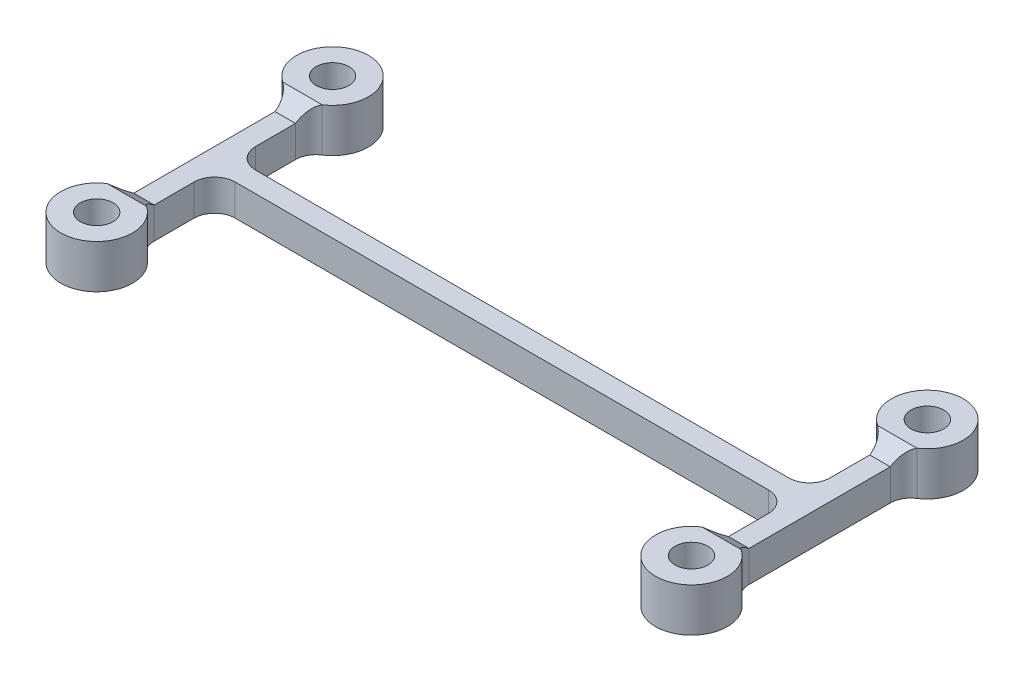
from build123d import *

# Parameters (mm, degrees)
BOSS_EXTRUDE1_DEPTH        = 4.25
F_3_2_3_2_DIAMETER_HOLE1_D = 3.2
CUT_EXTRUDE1_DEPTH         = 37.614339148
CUT_EXTRUDE1_DEPTH_BACK    = 37.614339148


with BuildPart() as part:
    # Sketch2 → Boss-Extrude1 (new body)
    with BuildSketch(Plane(origin=(0, 0, 0), x_dir=(1, 0, 0), z_dir=(0, 1, 0))):
        with BuildLine():
            Line((-26, -2.318619158), (26, -2.318619158))
            ThreePointArc((26, -2.318619158), (27.414213562, -2.904405596), (28, -4.318619158))
            Line((28, -4.318619158), (28, -8.208846929))
            ThreePointArc((28, -8.208846929), (27.758098146, -9.162309518), (27.090909091, -9.88512774))
            ThreePointArc((27.090909091, -9.88512774), (29, -16.318619158), (30.909090909, -9.88512774))
            ThreePointArc((30.909090909, -9.88512774), (30.241901854, -9.162309518), (30, -8.208846929))
            Line((30, -8.208846929), (30, 5.571608613))
            ThreePointArc((30, 5.571608613), (30.241901854, 6.525071203), (30.909090909, 7.247889424))
            ThreePointArc((30.909090909, 7.247889424), (29, 13.681380842), (27.090909091, 7.247889424))
            ThreePointArc((27.090909091, 7.247889424), (27.758098146, 6.525071203), (28, 5.571608613))
            Line((28, 5.571608613), (28, 1.681380842))
            ThreePointArc((28, 1.681380842), (27.414213562, 0.26716728), (26, -0.318619158))
            Line((26, -0.318619158), (-26, -0.318619158))
            ThreePointArc((-26, -0.318619158), (-27.414213562, 0.26716728), (-28, 1.681380842))
            Line((-28, 1.681380842), (-28, 5.571608613))
            ThreePointArc((-28, 5.571608613), (-27.758098146, 6.525071203), (-27.090909091, 7.247889424))
            ThreePointArc((-27.090909091, 7.247889424), (-29, 13.681380842), (-30.909090909, 7.247889424))
            ThreePointArc((-30.909090909, 7.247889424), (-30.241901854, 6.525071203), (-30, 5.571608613))
            Line((-30, 5.571608613), (-30, -8.208846929))
            ThreePointArc((-30, -8.208846929), (-30.241901854, -9.162309518), (-30.909090909, -9.88512774))
            ThreePointArc((-30.909090909, -9.88512774), (-29, -16.318619158), (-27.090909091, -9.88512774))
            ThreePointArc((-27.090909091, -9.88512774), (-27.758098146, -9.162309518), (-28, -8.208846929))
            Line((-28, -8.208846929), (-28, -4.318619158))
            ThreePointArc((-28, -4.318619158), (-27.414213562, -2.904405596), (-26, -2.318619158))
        make_face()
    extrude(amount=BOSS_EXTRUDE1_DEPTH)

    # Ø3.2 (3.2) Diameter Hole1 (through all)
    with Locations(Plane(origin=(0, 4.25, 0), x_dir=(1, 0, 0), z_dir=(0, 1, 0))):
        with Locations((-29, -12.818619158), (-29, 10.181380842), (29, 10.181380842), (29, -12.818619158)):
            Hole(F_3_2_3_2_DIAMETER_HOLE1_D / 2)

    # Sketch5 → Cut-Extrude1 (cut, two sides: drawn at the far end of the back side and taken through both)
    with BuildSketch(Plane(origin=(0, 0, 0), x_dir=(0, 0, -1), z_dir=(1, 0, 0)).offset(-CUT_EXTRUDE1_DEPTH_BACK)):
        Polygon((-8.208846929, 3.055472707), (5.571608613, 3.055472707), (7.247889424, 4.25), (-9.88512774, 4.25), align=None)
    extrude(amount=CUT_EXTRUDE1_DEPTH + CUT_EXTRUDE1_DEPTH_BACK, mode=Mode.SUBTRACT)


solid = part.part
